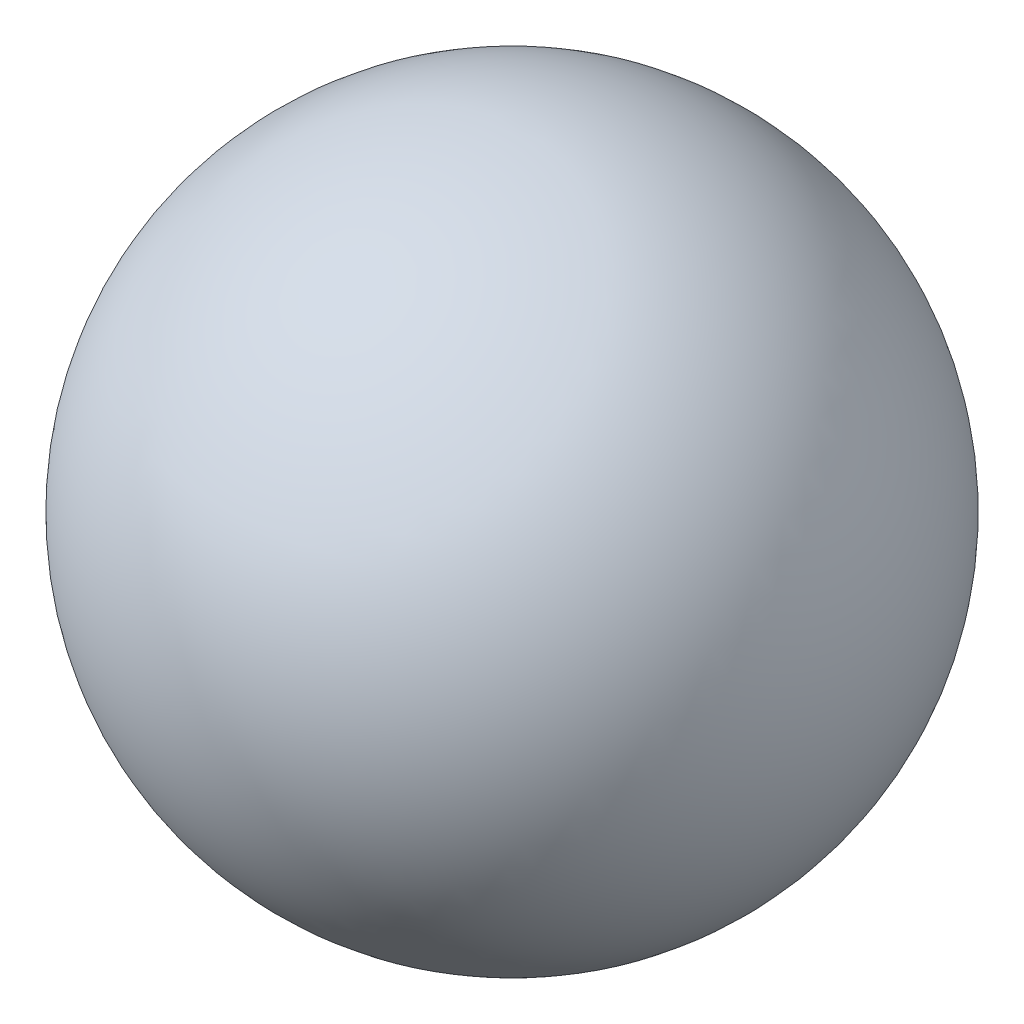
from build123d import *


with BuildPart() as part:
    # Esquisse2 → Révolution1 (revolve)
    with BuildSketch(Plane.XY):
        with BuildLine():
            Line((0, 30), (0, -30))
            ThreePointArc((0, -30), (-30, 0), (0, 30))
        make_face()
    revolve(axis=Axis((0, 30, 0), (0, -1, 0)))


solid = part.part
